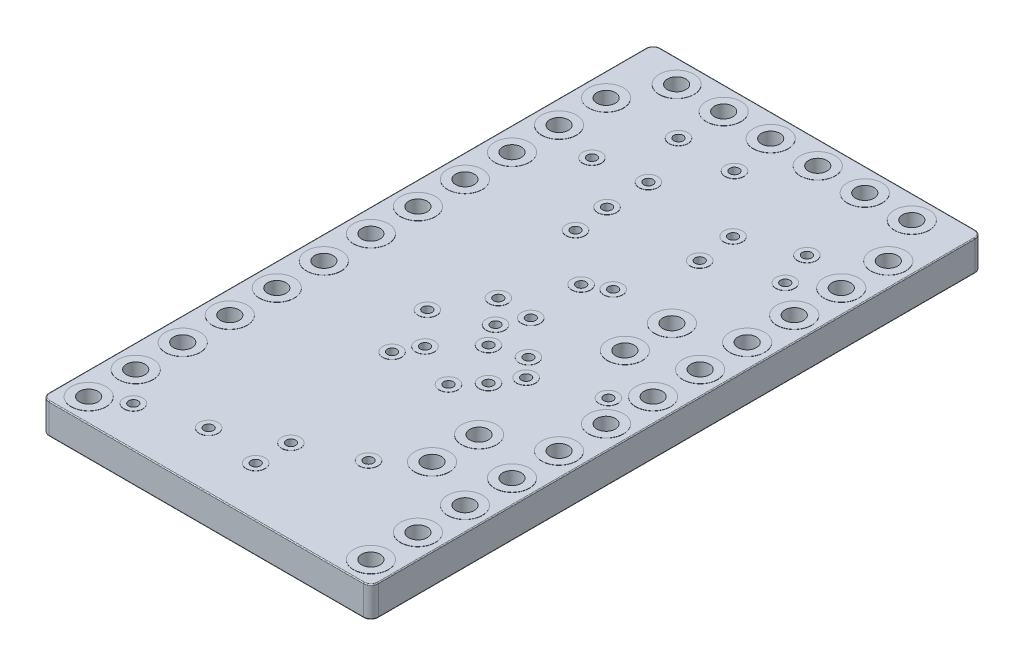
from build123d import *

# Parameters (mm, degrees)
SKETCH1_W           = 17.78
SKETCH1_H           = 33.02
BOARD_DEPTH         = 1.65
HEADER_HOLES_R      = 0.5
CUT_EXTRUDE1_DEPTH  = 38.538930459
SKETCH3_R           = 0.254
CUT_EXTRUDE2_DEPTH  = 38.538930459
BOSS_EXTRUDE1_START = 0.01
SKETCH4_R           = 0.508
SKETCH4_R_2         = 0.254
BOSS_EXTRUDE1_DEPTH = 0.01
BOSS_EXTRUDE2_START = 0.01
SKETCH5_R           = 0.94
SKETCH5_R_2         = 0.5
BOSS_EXTRUDE2_DEPTH = 0.01
FILLET1_R           = 0.4
FILLET2_R           = 0.05


with BuildPart() as part:
    # Sketch1 → Board (new body)
    with BuildSketch(Plane(origin=(0, 0, 0), x_dir=(1, 0, 0), z_dir=(0, 1, 0))):
        with Locations((8.89, 16.51)):
            Rectangle(SKETCH1_W, SKETCH1_H)
    extrude(amount=BOARD_DEPTH)

    # Header Holes → Cut-Extrude1 (cut, through all)
    with BuildSketch(Plane(origin=(0, 1.65, 0), x_dir=(1, 0, 0), z_dir=(0, 1, 0))):
        with Locations(Location((1.27, 1.27, 0), (0, 0, 270))):
            Circle(HEADER_HOLES_R)
        with Locations(Location((16.51, 1.27, 0), (0, 0, 90))):
            Circle(HEADER_HOLES_R)
        with Locations(Location((1.27, 3.81, 0), (0, 0, 270))):
            Circle(HEADER_HOLES_R)
        with Locations(Location((16.51, 3.81, 0), (0, 0, 90))):
            Circle(HEADER_HOLES_R)
        with Locations(Location((1.27, 6.35, 0), (0, 0, 270))):
            Circle(HEADER_HOLES_R)
        with Locations(Location((16.51, 6.35, 0), (0, 0, 90))):
            Circle(HEADER_HOLES_R)
        with Locations(Location((1.27, 8.89, 0), (0, 0, 270))):
            Circle(HEADER_HOLES_R)
        with Locations(Location((16.51, 8.89, 0), (0, 0, 90))):
            Circle(HEADER_HOLES_R)
        with Locations(Location((1.27, 11.43, 0), (0, 0, 270))):
            Circle(HEADER_HOLES_R)
        with Locations(Location((16.51, 11.43, 0), (0, 0, 90))):
            Circle(HEADER_HOLES_R)
        with Locations(Location((1.27, 13.97, 0), (0, 0, 270))):
            Circle(HEADER_HOLES_R)
        with Locations(Location((16.51, 13.97, 0), (0, 0, 90))):
            Circle(HEADER_HOLES_R)
        with Locations(Location((1.27, 16.51, 0), (0, 0, 270))):
            Circle(HEADER_HOLES_R)
        with Locations(Location((16.51, 16.51, 0), (0, 0, 90))):
            Circle(HEADER_HOLES_R)
        with Locations(Location((1.27, 19.05, 0), (0, 0, 270))):
            Circle(HEADER_HOLES_R)
        with Locations(Location((16.51, 19.05, 0), (0, 0, 90))):
            Circle(HEADER_HOLES_R)
        with Locations(Location((1.27, 21.59, 0), (0, 0, 270))):
            Circle(HEADER_HOLES_R)
        with Locations(Location((16.51, 21.59, 0), (0, 0, 90))):
            Circle(HEADER_HOLES_R)
        with Locations(Location((1.27, 24.13, 0), (0, 0, 270))):
            Circle(HEADER_HOLES_R)
        with Locations(Location((16.51, 24.13, 0), (0, 0, 90))):
            Circle(HEADER_HOLES_R)
        with Locations(Location((1.27, 26.67, 0), (0, 0, 270))):
            Circle(HEADER_HOLES_R)
        with Locations(Location((16.51, 26.67, 0), (0, 0, 90))):
            Circle(HEADER_HOLES_R)
        with Locations(Location((1.27, 29.21, 0), (0, 0, 270))):
            Circle(HEADER_HOLES_R)
        with Locations(Location((16.51, 29.21, 0), (0, 0, 90))):
            Circle(HEADER_HOLES_R)
        with Locations(Location((13.589, 7.493, 0), (0, 0, 270))):
            Circle(HEADER_HOLES_R)
        with Locations(Location((13.589, 10.033, 0), (0, 0, 270))):
            Circle(HEADER_HOLES_R)
        with Locations(Location((13.589, 17.907, 0), (0, 0, 270))):
            Circle(HEADER_HOLES_R)
        with Locations(Location((13.589, 20.447, 0), (0, 0, 270))):
            Circle(HEADER_HOLES_R)
        with Locations(Location((15.24, 31.75, 0), (0, 0, 270))):
            Circle(HEADER_HOLES_R)
        with Locations(Location((12.7, 31.75, 0), (0, 0, 270))):
            Circle(HEADER_HOLES_R)
        with Locations(Location((10.16, 31.75, 0), (0, 0, 270))):
            Circle(HEADER_HOLES_R)
        with Locations(Location((7.62, 31.75, 0), (0, 0, 270))):
            Circle(HEADER_HOLES_R)
        with Locations(Location((5.08, 31.75, 0), (0, 0, 270))):
            Circle(HEADER_HOLES_R)
        with Locations(Location((2.54, 31.75, 0), (0, 0, 270))):
            Circle(HEADER_HOLES_R)
    extrude(amount=-CUT_EXTRUDE1_DEPTH, mode=Mode.SUBTRACT)

    # Sketch3 → Cut-Extrude2 (cut, through all)
    with BuildSketch(Plane(origin=(0, 1.65, 0), x_dir=(1, 0, 0), z_dir=(0, 1, 0))):
        with Locations(Location((2.794, 2.159, 0), (0, 0, 270))):
            Circle(SKETCH3_R)
        with Locations(Location((5.969, 3.048, 0), (0, 0, 270))):
            Circle(SKETCH3_R)
        with Locations(Location((8.89, 4.572, 0), (0, 0, 270))):
            Circle(SKETCH3_R)
        with Locations(Location((8.89, 2.667, 0), (0, 0, 270))):
            Circle(SKETCH3_R)
        with Locations(Location((11.811, 5.842, 0), (0, 0, 270))):
            Circle(SKETCH3_R)
        with Locations(Location((7.366, 11.557, 0), (0, 0, 270))):
            Circle(SKETCH3_R)
        with Locations(Location((8.001, 12.7, 0), (0, 0, 270))):
            Circle(SKETCH3_R)
        with Locations(Location((10.414, 11.557, 0), (0, 0, 270))):
            Circle(SKETCH3_R)
        with Locations(Location((11.43, 12.7, 0), (0, 0, 270))):
            Circle(SKETCH3_R)
        with Locations(Location((6.35, 14.478, 0), (0, 0, 270))):
            Circle(SKETCH3_R)
        with Locations(Location((12.192, 13.97, 0), (0, 0, 270))):
            Circle(SKETCH3_R)
        with Locations(Location((11.303, 14.986, 0), (0, 0, 270))):
            Circle(SKETCH3_R)
        with Locations(Location((8.89, 15.621, 0), (0, 0, 270))):
            Circle(SKETCH3_R)
        with Locations(Location((9.525, 16.891, 0), (0, 0, 270))):
            Circle(SKETCH3_R)
        with Locations(Location((15.367, 15.24, 0), (0, 0, 270))):
            Circle(SKETCH3_R)
        with Locations(Location((7.7216, 16.9418, 0), (0, 0, 270))):
            Circle(SKETCH3_R)
        with Locations(Location((9.652, 14.478, 0), (0, 0, 270))):
            Circle(SKETCH3_R)
        with Locations(Location((9.3218, 19.812, 0), (0, 0, 270))):
            Circle(SKETCH3_R)
        with Locations(Location((10.414, 20.447, 0), (0, 0, 270))):
            Circle(SKETCH3_R)
        with Locations(Location((6.6294, 22.1996, 0), (0, 0, 270))):
            Circle(SKETCH3_R)
        with Locations(Location((6.4008, 24.13, 0), (0, 0, 270))):
            Circle(SKETCH3_R)
        with Locations(Location((6.35, 26.416, 0), (0, 0, 270))):
            Circle(SKETCH3_R)
        with Locations(Location((3.683, 26.035, 0), (0, 0, 270))):
            Circle(SKETCH3_R)
        with Locations(Location((5.1054, 29.2862, 0), (0, 0, 270))):
            Circle(SKETCH3_R)
        with Locations(Location((8.1534, 29.2608, 0), (0, 0, 270))):
            Circle(SKETCH3_R)
        with Locations(Location((11.4046, 24.13, 0), (0, 0, 270))):
            Circle(SKETCH3_R)
        with Locations(Location((11.176, 26.162, 0), (0, 0, 270))):
            Circle(SKETCH3_R)
        with Locations(Location((14.7574, 25.4, 0), (0, 0, 270))):
            Circle(SKETCH3_R)
        with Locations(Location((14.0462, 27.2796, 0), (0, 0, 270))):
            Circle(SKETCH3_R)
    extrude(amount=-CUT_EXTRUDE2_DEPTH, mode=Mode.SUBTRACT)

    # Sketch4 → Boss-Extrude1 (add)
    # profile 1 of 29: a face of its own
    with BuildSketch(Plane(origin=(0, 1.65, 0), x_dir=(1, 0, 0), z_dir=(0, 1, 0)).offset(BOSS_EXTRUDE1_START)):
        with Locations(Location((2.794, 2.159, 0), (0, 0, 90))):
            Circle(SKETCH4_R)
        with Locations(Location((2.794, 2.159, 0), (0, 0, 270))):
            Circle(SKETCH4_R_2, mode=Mode.SUBTRACT)
    # profile 2 of 29: a face of its own
    with BuildSketch(Plane(origin=(0, 1.65, 0), x_dir=(1, 0, 0), z_dir=(0, 1, 0)).offset(BOSS_EXTRUDE1_START)):
        with Locations(Location((5.969, 3.048, 0), (0, 0, 90))):
            Circle(SKETCH4_R)
        with Locations(Location((5.969, 3.048, 0), (0, 0, 270))):
            Circle(SKETCH4_R_2, mode=Mode.SUBTRACT)
    # profile 3 of 29: a face of its own
    with BuildSketch(Plane(origin=(0, 1.65, 0), x_dir=(1, 0, 0), z_dir=(0, 1, 0)).offset(BOSS_EXTRUDE1_START)):
        with Locations(Location((8.89, 4.572, 0), (0, 0, 90))):
            Circle(SKETCH4_R)
        with Locations(Location((8.89, 4.572, 0), (0, 0, 270))):
            Circle(SKETCH4_R_2, mode=Mode.SUBTRACT)
    # profile 4 of 29: a face of its own
    with BuildSketch(Plane(origin=(0, 1.65, 0), x_dir=(1, 0, 0), z_dir=(0, 1, 0)).offset(BOSS_EXTRUDE1_START)):
        with Locations(Location((8.89, 2.667, 0), (0, 0, 90))):
            Circle(SKETCH4_R)
        with Locations(Location((8.89, 2.667, 0), (0, 0, 270))):
            Circle(SKETCH4_R_2, mode=Mode.SUBTRACT)
    # profile 5 of 29: a face of its own
    with BuildSketch(Plane(origin=(0, 1.65, 0), x_dir=(1, 0, 0), z_dir=(0, 1, 0)).offset(BOSS_EXTRUDE1_START)):
        with Locations(Location((11.811, 5.842, 0), (0, 0, 90))):
            Circle(SKETCH4_R)
        with Locations(Location((11.811, 5.842, 0), (0, 0, 270))):
            Circle(SKETCH4_R_2, mode=Mode.SUBTRACT)
    # profile 6 of 29: a face of its own
    with BuildSketch(Plane(origin=(0, 1.65, 0), x_dir=(1, 0, 0), z_dir=(0, 1, 0)).offset(BOSS_EXTRUDE1_START)):
        with Locations(Location((7.366, 11.557, 0), (0, 0, 90))):
            Circle(SKETCH4_R)
        with Locations(Location((7.366, 11.557, 0), (0, 0, 270))):
            Circle(SKETCH4_R_2, mode=Mode.SUBTRACT)
    # profile 7 of 29: a face of its own
    with BuildSketch(Plane(origin=(0, 1.65, 0), x_dir=(1, 0, 0), z_dir=(0, 1, 0)).offset(BOSS_EXTRUDE1_START)):
        with Locations(Location((8.001, 12.7, 0), (0, 0, 90))):
            Circle(SKETCH4_R)
        with Locations(Location((8.001, 12.7, 0), (0, 0, 270))):
            Circle(SKETCH4_R_2, mode=Mode.SUBTRACT)
    # profile 8 of 29: a face of its own
    with BuildSketch(Plane(origin=(0, 1.65, 0), x_dir=(1, 0, 0), z_dir=(0, 1, 0)).offset(BOSS_EXTRUDE1_START)):
        with Locations(Location((10.414, 11.557, 0), (0, 0, 90))):
            Circle(SKETCH4_R)
        with Locations(Location((10.414, 11.557, 0), (0, 0, 270))):
            Circle(SKETCH4_R_2, mode=Mode.SUBTRACT)
    # profile 9 of 29: a face of its own
    with BuildSketch(Plane(origin=(0, 1.65, 0), x_dir=(1, 0, 0), z_dir=(0, 1, 0)).offset(BOSS_EXTRUDE1_START)):
        with Locations(Location((11.43, 12.7, 0), (0, 0, 90))):
            Circle(SKETCH4_R)
        with Locations(Location((11.43, 12.7, 0), (0, 0, 270))):
            Circle(SKETCH4_R_2, mode=Mode.SUBTRACT)
    # profile 10 of 29: a face of its own
    with BuildSketch(Plane(origin=(0, 1.65, 0), x_dir=(1, 0, 0), z_dir=(0, 1, 0)).offset(BOSS_EXTRUDE1_START)):
        with Locations(Location((9.652, 14.478, 0), (0, 0, 90))):
            Circle(SKETCH4_R)
        with Locations(Location((9.652, 14.478, 0), (0, 0, 270))):
            Circle(SKETCH4_R_2, mode=Mode.SUBTRACT)
    # profile 11 of 29: a face of its own
    with BuildSketch(Plane(origin=(0, 1.65, 0), x_dir=(1, 0, 0), z_dir=(0, 1, 0)).offset(BOSS_EXTRUDE1_START)):
        with Locations(Location((6.35, 14.478, 0), (0, 0, 90))):
            Circle(SKETCH4_R)
        with Locations(Location((6.35, 14.478, 0), (0, 0, 270))):
            Circle(SKETCH4_R_2, mode=Mode.SUBTRACT)
    # profile 12 of 29: a face of its own
    with BuildSketch(Plane(origin=(0, 1.65, 0), x_dir=(1, 0, 0), z_dir=(0, 1, 0)).offset(BOSS_EXTRUDE1_START)):
        with Locations(Location((11.303, 14.986, 0), (0, 0, 90))):
            Circle(SKETCH4_R)
        with Locations(Location((11.303, 14.986, 0), (0, 0, 270))):
            Circle(SKETCH4_R_2, mode=Mode.SUBTRACT)
    # profile 13 of 29: a face of its own
    with BuildSketch(Plane(origin=(0, 1.65, 0), x_dir=(1, 0, 0), z_dir=(0, 1, 0)).offset(BOSS_EXTRUDE1_START)):
        with Locations(Location((12.192, 13.97, 0), (0, 0, 90))):
            Circle(SKETCH4_R)
        with Locations(Location((12.192, 13.97, 0), (0, 0, 270))):
            Circle(SKETCH4_R_2, mode=Mode.SUBTRACT)
    # profile 14 of 29: a face of its own
    with BuildSketch(Plane(origin=(0, 1.65, 0), x_dir=(1, 0, 0), z_dir=(0, 1, 0)).offset(BOSS_EXTRUDE1_START)):
        with Locations(Location((15.367, 15.24, 0), (0, 0, 90))):
            Circle(SKETCH4_R)
        with Locations(Location((15.367, 15.24, 0), (0, 0, 270))):
            Circle(SKETCH4_R_2, mode=Mode.SUBTRACT)
    # profile 15 of 29: a face of its own
    with BuildSketch(Plane(origin=(0, 1.65, 0), x_dir=(1, 0, 0), z_dir=(0, 1, 0)).offset(BOSS_EXTRUDE1_START)):
        with Locations(Location((8.89, 15.621, 0), (0, 0, 90))):
            Circle(SKETCH4_R)
        with Locations(Location((8.89, 15.621, 0), (0, 0, 270))):
            Circle(SKETCH4_R_2, mode=Mode.SUBTRACT)
    # profile 16 of 29: a face of its own
    with BuildSketch(Plane(origin=(0, 1.65, 0), x_dir=(1, 0, 0), z_dir=(0, 1, 0)).offset(BOSS_EXTRUDE1_START)):
        with Locations(Location((7.7216, 16.9418, 0), (0, 0, 90))):
            Circle(SKETCH4_R)
        with Locations(Location((7.7216, 16.9418, 0), (0, 0, 270))):
            Circle(SKETCH4_R_2, mode=Mode.SUBTRACT)
    # profile 17 of 29: a face of its own
    with BuildSketch(Plane(origin=(0, 1.65, 0), x_dir=(1, 0, 0), z_dir=(0, 1, 0)).offset(BOSS_EXTRUDE1_START)):
        with Locations(Location((9.525, 16.891, 0), (0, 0, 90))):
            Circle(SKETCH4_R)
        with Locations(Location((9.525, 16.891, 0), (0, 0, 270))):
            Circle(SKETCH4_R_2, mode=Mode.SUBTRACT)
    # profile 18 of 29: a face of its own
    with BuildSketch(Plane(origin=(0, 1.65, 0), x_dir=(1, 0, 0), z_dir=(0, 1, 0)).offset(BOSS_EXTRUDE1_START)):
        with Locations(Location((9.3218, 19.812, 0), (0, 0, 90))):
            Circle(SKETCH4_R)
        with Locations(Location((9.3218, 19.812, 0), (0, 0, 270))):
            Circle(SKETCH4_R_2, mode=Mode.SUBTRACT)
    # profile 19 of 29: a face of its own
    with BuildSketch(Plane(origin=(0, 1.65, 0), x_dir=(1, 0, 0), z_dir=(0, 1, 0)).offset(BOSS_EXTRUDE1_START)):
        with Locations(Location((10.414, 20.447, 0), (0, 0, 90))):
            Circle(SKETCH4_R)
        with Locations(Location((10.414, 20.447, 0), (0, 0, 270))):
            Circle(SKETCH4_R_2, mode=Mode.SUBTRACT)
    # profile 20 of 29: a face of its own
    with BuildSketch(Plane(origin=(0, 1.65, 0), x_dir=(1, 0, 0), z_dir=(0, 1, 0)).offset(BOSS_EXTRUDE1_START)):
        with Locations(Location((6.6294, 22.1996, 0), (0, 0, 90))):
            Circle(SKETCH4_R)
        with Locations(Location((6.6294, 22.1996, 0), (0, 0, 270))):
            Circle(SKETCH4_R_2, mode=Mode.SUBTRACT)
    # profile 21 of 29: a face of its own
    with BuildSketch(Plane(origin=(0, 1.65, 0), x_dir=(1, 0, 0), z_dir=(0, 1, 0)).offset(BOSS_EXTRUDE1_START)):
        with Locations(Location((6.4008, 24.13, 0), (0, 0, 90))):
            Circle(SKETCH4_R)
        with Locations(Location((6.4008, 24.13, 0), (0, 0, 270))):
            Circle(SKETCH4_R_2, mode=Mode.SUBTRACT)
    # profile 22 of 29: a face of its own
    with BuildSketch(Plane(origin=(0, 1.65, 0), x_dir=(1, 0, 0), z_dir=(0, 1, 0)).offset(BOSS_EXTRUDE1_START)):
        with Locations(Location((3.683, 26.035, 0), (0, 0, 90))):
            Circle(SKETCH4_R)
        with Locations(Location((3.683, 26.035, 0), (0, 0, 270))):
            Circle(SKETCH4_R_2, mode=Mode.SUBTRACT)
    # profile 23 of 29: a face of its own
    with BuildSketch(Plane(origin=(0, 1.65, 0), x_dir=(1, 0, 0), z_dir=(0, 1, 0)).offset(BOSS_EXTRUDE1_START)):
        with Locations(Location((6.35, 26.416, 0), (0, 0, 90))):
            Circle(SKETCH4_R)
        with Locations(Location((6.35, 26.416, 0), (0, 0, 270))):
            Circle(SKETCH4_R_2, mode=Mode.SUBTRACT)
    # profile 24 of 29: a face of its own
    with BuildSketch(Plane(origin=(0, 1.65, 0), x_dir=(1, 0, 0), z_dir=(0, 1, 0)).offset(BOSS_EXTRUDE1_START)):
        with Locations(Location((11.4046, 24.13, 0), (0, 0, 90))):
            Circle(SKETCH4_R)
        with Locations(Location((11.4046, 24.13, 0), (0, 0, 270))):
            Circle(SKETCH4_R_2, mode=Mode.SUBTRACT)
    # profile 25 of 29: a face of its own
    with BuildSketch(Plane(origin=(0, 1.65, 0), x_dir=(1, 0, 0), z_dir=(0, 1, 0)).offset(BOSS_EXTRUDE1_START)):
        with Locations(Location((11.176, 26.162, 0), (0, 0, 90))):
            Circle(SKETCH4_R)
        with Locations(Location((11.176, 26.162, 0), (0, 0, 270))):
            Circle(SKETCH4_R_2, mode=Mode.SUBTRACT)
    # profile 26 of 29: a face of its own
    with BuildSketch(Plane(origin=(0, 1.65, 0), x_dir=(1, 0, 0), z_dir=(0, 1, 0)).offset(BOSS_EXTRUDE1_START)):
        with Locations(Location((14.0462, 27.2796, 0), (0, 0, 90))):
            Circle(SKETCH4_R)
        with Locations(Location((14.0462, 27.2796, 0), (0, 0, 270))):
            Circle(SKETCH4_R_2, mode=Mode.SUBTRACT)
    # profile 27 of 29: a face of its own
    with BuildSketch(Plane(origin=(0, 1.65, 0), x_dir=(1, 0, 0), z_dir=(0, 1, 0)).offset(BOSS_EXTRUDE1_START)):
        with Locations(Location((14.7574, 25.4, 0), (0, 0, 90))):
            Circle(SKETCH4_R)
        with Locations(Location((14.7574, 25.4, 0), (0, 0, 270))):
            Circle(SKETCH4_R_2, mode=Mode.SUBTRACT)
    # profile 28 of 29: a face of its own
    with BuildSketch(Plane(origin=(0, 1.65, 0), x_dir=(1, 0, 0), z_dir=(0, 1, 0)).offset(BOSS_EXTRUDE1_START)):
        with Locations(Location((8.1534, 29.2608, 0), (0, 0, 90))):
            Circle(SKETCH4_R)
        with Locations(Location((8.1534, 29.2608, 0), (0, 0, 270))):
            Circle(SKETCH4_R_2, mode=Mode.SUBTRACT)
    # profile 29 of 29: a face of its own
    with BuildSketch(Plane(origin=(0, 1.65, 0), x_dir=(1, 0, 0), z_dir=(0, 1, 0)).offset(BOSS_EXTRUDE1_START)):
        with Locations(Location((5.1054, 29.2862, 0), (0, 0, 90))):
            Circle(SKETCH4_R)
        with Locations(Location((5.1054, 29.2862, 0), (0, 0, 270))):
            Circle(SKETCH4_R_2, mode=Mode.SUBTRACT)
    boss_extrude1 = extrude(amount=-BOSS_EXTRUDE1_DEPTH)

    # Sketch5 → Boss-Extrude2 (add)
    # profile 1 of 34: a face of its own
    with BuildSketch(Plane(origin=(0, 1.65, 0), x_dir=(1, 0, 0), z_dir=(0, 1, 0)).offset(BOSS_EXTRUDE2_START)):
        with Locations(Location((1.27, 1.27, 0), (0, 0, 90))):
            Circle(SKETCH5_R)
        with Locations(Location((1.27, 1.27, 0), (0, 0, 270))):
            Circle(SKETCH5_R_2, mode=Mode.SUBTRACT)
    # profile 2 of 34: a face of its own
    with BuildSketch(Plane(origin=(0, 1.65, 0), x_dir=(1, 0, 0), z_dir=(0, 1, 0)).offset(BOSS_EXTRUDE2_START)):
        with Locations(Location((1.27, 3.81, 0), (0, 0, 90))):
            Circle(SKETCH5_R)
        with Locations(Location((1.27, 3.81, 0), (0, 0, 270))):
            Circle(SKETCH5_R_2, mode=Mode.SUBTRACT)
    # profile 3 of 34: a face of its own
    with BuildSketch(Plane(origin=(0, 1.65, 0), x_dir=(1, 0, 0), z_dir=(0, 1, 0)).offset(BOSS_EXTRUDE2_START)):
        with Locations(Location((1.27, 6.35, 0), (0, 0, 90))):
            Circle(SKETCH5_R)
        with Locations(Location((1.27, 6.35, 0), (0, 0, 270))):
            Circle(SKETCH5_R_2, mode=Mode.SUBTRACT)
    # profile 4 of 34: a face of its own
    with BuildSketch(Plane(origin=(0, 1.65, 0), x_dir=(1, 0, 0), z_dir=(0, 1, 0)).offset(BOSS_EXTRUDE2_START)):
        with Locations(Location((1.27, 8.89, 0), (0, 0, 90))):
            Circle(SKETCH5_R)
        with Locations(Location((1.27, 8.89, 0), (0, 0, 270))):
            Circle(SKETCH5_R_2, mode=Mode.SUBTRACT)
    # profile 5 of 34: a face of its own
    with BuildSketch(Plane(origin=(0, 1.65, 0), x_dir=(1, 0, 0), z_dir=(0, 1, 0)).offset(BOSS_EXTRUDE2_START)):
        with Locations(Location((1.27, 11.43, 0), (0, 0, 90))):
            Circle(SKETCH5_R)
        with Locations(Location((1.27, 11.43, 0), (0, 0, 270))):
            Circle(SKETCH5_R_2, mode=Mode.SUBTRACT)
    # profile 6 of 34: a face of its own
    with BuildSketch(Plane(origin=(0, 1.65, 0), x_dir=(1, 0, 0), z_dir=(0, 1, 0)).offset(BOSS_EXTRUDE2_START)):
        with Locations(Location((1.27, 13.97, 0), (0, 0, 90))):
            Circle(SKETCH5_R)
        with Locations(Location((1.27, 13.97, 0), (0, 0, 270))):
            Circle(SKETCH5_R_2, mode=Mode.SUBTRACT)
    # profile 7 of 34: a face of its own
    with BuildSketch(Plane(origin=(0, 1.65, 0), x_dir=(1, 0, 0), z_dir=(0, 1, 0)).offset(BOSS_EXTRUDE2_START)):
        with Locations(Location((1.27, 16.51, 0), (0, 0, 90))):
            Circle(SKETCH5_R)
        with Locations(Location((1.27, 16.51, 0), (0, 0, 270))):
            Circle(SKETCH5_R_2, mode=Mode.SUBTRACT)
    # profile 8 of 34: a face of its own
    with BuildSketch(Plane(origin=(0, 1.65, 0), x_dir=(1, 0, 0), z_dir=(0, 1, 0)).offset(BOSS_EXTRUDE2_START)):
        with Locations(Location((1.27, 19.05, 0), (0, 0, 90))):
            Circle(SKETCH5_R)
        with Locations(Location((1.27, 19.05, 0), (0, 0, 270))):
            Circle(SKETCH5_R_2, mode=Mode.SUBTRACT)
    # profile 9 of 34: a face of its own
    with BuildSketch(Plane(origin=(0, 1.65, 0), x_dir=(1, 0, 0), z_dir=(0, 1, 0)).offset(BOSS_EXTRUDE2_START)):
        with Locations(Location((1.27, 21.59, 0), (0, 0, 90))):
            Circle(SKETCH5_R)
        with Locations(Location((1.27, 21.59, 0), (0, 0, 270))):
            Circle(SKETCH5_R_2, mode=Mode.SUBTRACT)
    # profile 10 of 34: a face of its own
    with BuildSketch(Plane(origin=(0, 1.65, 0), x_dir=(1, 0, 0), z_dir=(0, 1, 0)).offset(BOSS_EXTRUDE2_START)):
        with Locations(Location((1.27, 24.13, 0), (0, 0, 90))):
            Circle(SKETCH5_R)
        with Locations(Location((1.27, 24.13, 0), (0, 0, 270))):
            Circle(SKETCH5_R_2, mode=Mode.SUBTRACT)
    # profile 11 of 34: a face of its own
    with BuildSketch(Plane(origin=(0, 1.65, 0), x_dir=(1, 0, 0), z_dir=(0, 1, 0)).offset(BOSS_EXTRUDE2_START)):
        with Locations(Location((1.27, 26.67, 0), (0, 0, 90))):
            Circle(SKETCH5_R)
        with Locations(Location((1.27, 26.67, 0), (0, 0, 270))):
            Circle(SKETCH5_R_2, mode=Mode.SUBTRACT)
    # profile 12 of 34: a face of its own
    with BuildSketch(Plane(origin=(0, 1.65, 0), x_dir=(1, 0, 0), z_dir=(0, 1, 0)).offset(BOSS_EXTRUDE2_START)):
        with Locations(Location((1.27, 29.21, 0), (0, 0, 90))):
            Circle(SKETCH5_R)
        with Locations(Location((1.27, 29.21, 0), (0, 0, 270))):
            Circle(SKETCH5_R_2, mode=Mode.SUBTRACT)
    # profile 13 of 34: a face of its own
    with BuildSketch(Plane(origin=(0, 1.65, 0), x_dir=(1, 0, 0), z_dir=(0, 1, 0)).offset(BOSS_EXTRUDE2_START)):
        with Locations(Location((16.51, 29.21, 0), (0, 0, 90))):
            Circle(SKETCH5_R)
        with Locations(Location((16.51, 29.21, 0), (0, 0, 90))):
            Circle(SKETCH5_R_2, mode=Mode.SUBTRACT)
    # profile 14 of 34: a face of its own
    with BuildSketch(Plane(origin=(0, 1.65, 0), x_dir=(1, 0, 0), z_dir=(0, 1, 0)).offset(BOSS_EXTRUDE2_START)):
        with Locations(Location((16.51, 26.67, 0), (0, 0, 90))):
            Circle(SKETCH5_R)
        with Locations(Location((16.51, 26.67, 0), (0, 0, 90))):
            Circle(SKETCH5_R_2, mode=Mode.SUBTRACT)
    # profile 15 of 34: a face of its own
    with BuildSketch(Plane(origin=(0, 1.65, 0), x_dir=(1, 0, 0), z_dir=(0, 1, 0)).offset(BOSS_EXTRUDE2_START)):
        with Locations(Location((16.51, 24.13, 0), (0, 0, 90))):
            Circle(SKETCH5_R)
        with Locations(Location((16.51, 24.13, 0), (0, 0, 90))):
            Circle(SKETCH5_R_2, mode=Mode.SUBTRACT)
    # profile 16 of 34: a face of its own
    with BuildSketch(Plane(origin=(0, 1.65, 0), x_dir=(1, 0, 0), z_dir=(0, 1, 0)).offset(BOSS_EXTRUDE2_START)):
        with Locations(Location((16.51, 21.59, 0), (0, 0, 90))):
            Circle(SKETCH5_R)
        with Locations(Location((16.51, 21.59, 0), (0, 0, 90))):
            Circle(SKETCH5_R_2, mode=Mode.SUBTRACT)
    # profile 17 of 34: a face of its own
    with BuildSketch(Plane(origin=(0, 1.65, 0), x_dir=(1, 0, 0), z_dir=(0, 1, 0)).offset(BOSS_EXTRUDE2_START)):
        with Locations(Location((16.51, 19.05, 0), (0, 0, 90))):
            Circle(SKETCH5_R)
        with Locations(Location((16.51, 19.05, 0), (0, 0, 90))):
            Circle(SKETCH5_R_2, mode=Mode.SUBTRACT)
    # profile 18 of 34: a face of its own
    with BuildSketch(Plane(origin=(0, 1.65, 0), x_dir=(1, 0, 0), z_dir=(0, 1, 0)).offset(BOSS_EXTRUDE2_START)):
        with Locations(Location((16.51, 16.51, 0), (0, 0, 90))):
            Circle(SKETCH5_R)
        with Locations(Location((16.51, 16.51, 0), (0, 0, 90))):
            Circle(SKETCH5_R_2, mode=Mode.SUBTRACT)
    # profile 19 of 34: a face of its own
    with BuildSketch(Plane(origin=(0, 1.65, 0), x_dir=(1, 0, 0), z_dir=(0, 1, 0)).offset(BOSS_EXTRUDE2_START)):
        with Locations(Location((16.51, 13.97, 0), (0, 0, 90))):
            Circle(SKETCH5_R)
        with Locations(Location((16.51, 13.97, 0), (0, 0, 90))):
            Circle(SKETCH5_R_2, mode=Mode.SUBTRACT)
    # profile 20 of 34: a face of its own
    with BuildSketch(Plane(origin=(0, 1.65, 0), x_dir=(1, 0, 0), z_dir=(0, 1, 0)).offset(BOSS_EXTRUDE2_START)):
        with Locations(Location((16.51, 11.43, 0), (0, 0, 90))):
            Circle(SKETCH5_R)
        with Locations(Location((16.51, 11.43, 0), (0, 0, 90))):
            Circle(SKETCH5_R_2, mode=Mode.SUBTRACT)
    # profile 21 of 34: a face of its own
    with BuildSketch(Plane(origin=(0, 1.65, 0), x_dir=(1, 0, 0), z_dir=(0, 1, 0)).offset(BOSS_EXTRUDE2_START)):
        with Locations(Location((16.51, 8.89, 0), (0, 0, 90))):
            Circle(SKETCH5_R)
        with Locations(Location((16.51, 8.89, 0), (0, 0, 90))):
            Circle(SKETCH5_R_2, mode=Mode.SUBTRACT)
    # profile 22 of 34: a face of its own
    with BuildSketch(Plane(origin=(0, 1.65, 0), x_dir=(1, 0, 0), z_dir=(0, 1, 0)).offset(BOSS_EXTRUDE2_START)):
        with Locations(Location((16.51, 6.35, 0), (0, 0, 90))):
            Circle(SKETCH5_R)
        with Locations(Location((16.51, 6.35, 0), (0, 0, 90))):
            Circle(SKETCH5_R_2, mode=Mode.SUBTRACT)
    # profile 23 of 34: a face of its own
    with BuildSketch(Plane(origin=(0, 1.65, 0), x_dir=(1, 0, 0), z_dir=(0, 1, 0)).offset(BOSS_EXTRUDE2_START)):
        with Locations(Location((16.51, 3.81, 0), (0, 0, 90))):
            Circle(SKETCH5_R)
        with Locations(Location((16.51, 3.81, 0), (0, 0, 90))):
            Circle(SKETCH5_R_2, mode=Mode.SUBTRACT)
    # profile 24 of 34: a face of its own
    with BuildSketch(Plane(origin=(0, 1.65, 0), x_dir=(1, 0, 0), z_dir=(0, 1, 0)).offset(BOSS_EXTRUDE2_START)):
        with Locations(Location((16.51, 1.27, 0), (0, 0, 90))):
            Circle(SKETCH5_R)
        with Locations(Location((16.51, 1.27, 0), (0, 0, 90))):
            Circle(SKETCH5_R_2, mode=Mode.SUBTRACT)
    # profile 25 of 34: a face of its own
    with BuildSketch(Plane(origin=(0, 1.65, 0), x_dir=(1, 0, 0), z_dir=(0, 1, 0)).offset(BOSS_EXTRUDE2_START)):
        with Locations(Location((2.54, 31.75, 0), (0, 0, 90))):
            Circle(SKETCH5_R)
        with Locations(Location((2.54, 31.75, 0), (0, 0, 270))):
            Circle(SKETCH5_R_2, mode=Mode.SUBTRACT)
    # profile 26 of 34: a face of its own
    with BuildSketch(Plane(origin=(0, 1.65, 0), x_dir=(1, 0, 0), z_dir=(0, 1, 0)).offset(BOSS_EXTRUDE2_START)):
        with Locations(Location((5.08, 31.75, 0), (0, 0, 90))):
            Circle(SKETCH5_R)
        with Locations(Location((5.08, 31.75, 0), (0, 0, 270))):
            Circle(SKETCH5_R_2, mode=Mode.SUBTRACT)
    # profile 27 of 34: a face of its own
    with BuildSketch(Plane(origin=(0, 1.65, 0), x_dir=(1, 0, 0), z_dir=(0, 1, 0)).offset(BOSS_EXTRUDE2_START)):
        with Locations(Location((7.62, 31.75, 0), (0, 0, 90))):
            Circle(SKETCH5_R)
        with Locations(Location((7.62, 31.75, 0), (0, 0, 270))):
            Circle(SKETCH5_R_2, mode=Mode.SUBTRACT)
    # profile 28 of 34: a face of its own
    with BuildSketch(Plane(origin=(0, 1.65, 0), x_dir=(1, 0, 0), z_dir=(0, 1, 0)).offset(BOSS_EXTRUDE2_START)):
        with Locations(Location((10.16, 31.75, 0), (0, 0, 90))):
            Circle(SKETCH5_R)
        with Locations(Location((10.16, 31.75, 0), (0, 0, 270))):
            Circle(SKETCH5_R_2, mode=Mode.SUBTRACT)
    # profile 29 of 34: a face of its own
    with BuildSketch(Plane(origin=(0, 1.65, 0), x_dir=(1, 0, 0), z_dir=(0, 1, 0)).offset(BOSS_EXTRUDE2_START)):
        with Locations(Location((12.7, 31.75, 0), (0, 0, 90))):
            Circle(SKETCH5_R)
        with Locations(Location((12.7, 31.75, 0), (0, 0, 270))):
            Circle(SKETCH5_R_2, mode=Mode.SUBTRACT)
    # profile 30 of 34: a face of its own
    with BuildSketch(Plane(origin=(0, 1.65, 0), x_dir=(1, 0, 0), z_dir=(0, 1, 0)).offset(BOSS_EXTRUDE2_START)):
        with Locations(Location((15.24, 31.75, 0), (0, 0, 90))):
            Circle(SKETCH5_R)
        with Locations(Location((15.24, 31.75, 0), (0, 0, 270))):
            Circle(SKETCH5_R_2, mode=Mode.SUBTRACT)
    # profile 31 of 34: a face of its own
    with BuildSketch(Plane(origin=(0, 1.65, 0), x_dir=(1, 0, 0), z_dir=(0, 1, 0)).offset(BOSS_EXTRUDE2_START)):
        with Locations(Location((13.589, 10.033, 0), (0, 0, 90))):
            Circle(SKETCH5_R)
        with Locations(Location((13.589, 10.033, 0), (0, 0, 270))):
            Circle(SKETCH5_R_2, mode=Mode.SUBTRACT)
    # profile 32 of 34: a face of its own
    with BuildSketch(Plane(origin=(0, 1.65, 0), x_dir=(1, 0, 0), z_dir=(0, 1, 0)).offset(BOSS_EXTRUDE2_START)):
        with Locations(Location((13.589, 7.493, 0), (0, 0, 90))):
            Circle(SKETCH5_R)
        with Locations(Location((13.589, 7.493, 0), (0, 0, 270))):
            Circle(SKETCH5_R_2, mode=Mode.SUBTRACT)
    # profile 33 of 34: a face of its own
    with BuildSketch(Plane(origin=(0, 1.65, 0), x_dir=(1, 0, 0), z_dir=(0, 1, 0)).offset(BOSS_EXTRUDE2_START)):
        with Locations(Location((13.589, 20.447, 0), (0, 0, 90))):
            Circle(SKETCH5_R)
        with Locations(Location((13.589, 20.447, 0), (0, 0, 270))):
            Circle(SKETCH5_R_2, mode=Mode.SUBTRACT)
    # profile 34 of 34: a face of its own
    with BuildSketch(Plane(origin=(0, 1.65, 0), x_dir=(1, 0, 0), z_dir=(0, 1, 0)).offset(BOSS_EXTRUDE2_START)):
        with Locations(Location((13.589, 17.907, 0), (0, 0, 90))):
            Circle(SKETCH5_R)
        with Locations(Location((13.589, 17.907, 0), (0, 0, 270))):
            Circle(SKETCH5_R_2, mode=Mode.SUBTRACT)
    boss_extrude2 = extrude(amount=-BOSS_EXTRUDE2_DEPTH)

    # Mirror1: Boss-Extrude1, Boss-Extrude2 across plane
    add(boss_extrude1.mirror(Plane.ZX.offset(0.825)))
    add(boss_extrude2.mirror(Plane.ZX.offset(0.825)))

    # Fillet1
    fillet1_edges = [part.edges().sort_by_distance(p)[0] for p in [
        (0, 0.825, -33.02),
        (17.78, 0.825, -33.02),
        (17.78, 0.825, 0),
        (0, 0.825, 0),
    ]]
    fillet(fillet1_edges, radius=FILLET1_R)

    # Fillet2
    fillet2_edges = [part.edges().sort_by_distance(p)[0] for p in [
        (0, 0, -16.51),
        (0, 1.65, -16.51),
        (8.89, 0, -33.02),
        (17.78, 0, -16.51),
        (8.89, 0, 0),
        (17.662842712, 0, -0.117157288),
        (0.117157288, 0, -0.117157288),
        (17.662842712, 0, -32.902842712),
        (0.117157288, 0, -32.902842712),
        (8.89, 1.65, -33.02),
        (8.89, 1.65, 0),
        (17.78, 1.65, -16.51),
        (17.662842712, 1.65, -0.117157288),
        (0.117157288, 1.65, -0.117157288),
        (17.662842712, 1.65, -32.902842712),
        (0.117157288, 1.65, -32.902842712),
    ]]
    fillet(fillet2_edges, radius=FILLET2_R)


solid = part.part
